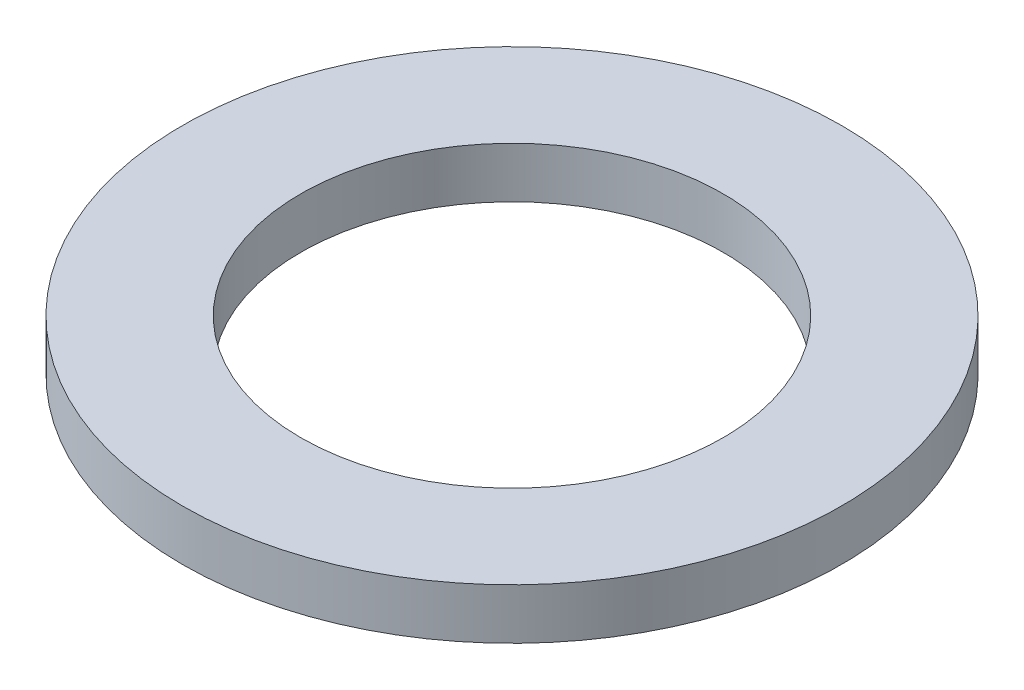
from build123d import *

# Parameters (mm, degrees)
SKETCH_1_R      = 19.5
SKETCH_1_R_2    = 12.5
EXTRUDE_1_DEPTH = 3


with BuildPart() as part:
    # 草图1 → 凸台-拉伸1 (new body)
    with BuildSketch(Plane(origin=(0, 0, 0), x_dir=(1, 0, 0), z_dir=(0, 1, 0))):
        with Locations(Location((0, 0, 0), (0, 0, 270))):
            Circle(SKETCH_1_R)
        with Locations(Location((0, 0, 0), (0, 0, 270))):
            Circle(SKETCH_1_R_2, mode=Mode.SUBTRACT)
    extrude(amount=EXTRUDE_1_DEPTH)


solid = part.part
